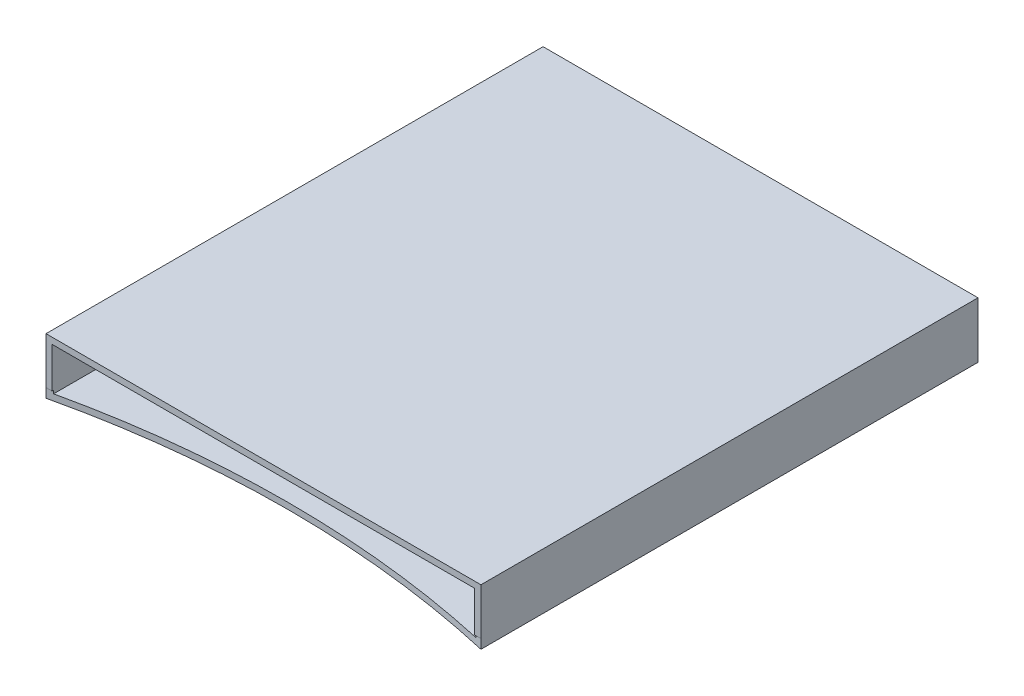
from build123d import *

# Parameters (mm, degrees)
SKETCH_1_W          = 14
SKETCH_1_H          = 16
EXTRUDE_1_DEPTH     = 1.8
SHELL_1_T           = -0.2
CUT_EXTRUDE_2_DEPTH = 0.3


with BuildPart() as part:
    # 草图1 → 拉伸1 (new body)
    with BuildSketch(Plane(origin=(0, 0, 0), x_dir=(1, 0, 0), z_dir=(0, 1, 0))):
        Rectangle(SKETCH_1_W, SKETCH_1_H)
    extrude(amount=EXTRUDE_1_DEPTH)

    # 抽壳1
    shell_1_openings = [part.faces().sort_by_distance(p)[0] for p in [
        (0, 0.9, 8),
    ]]
    offset(amount=SHELL_1_T, openings=shell_1_openings, kind=Kind.INTERSECTION)

    # 草图2 → 切除-拉伸2 (cut)
    with BuildSketch(Plane.XZ):
        with BuildLine():
            Line((7, 8), (-7, 8))
            ThreePointArc((-7, 8), (0, 7.20758668), (7, 8))
        make_face()
    extrude(amount=-CUT_EXTRUDE_2_DEPTH, mode=Mode.SUBTRACT)


solid = part.part
